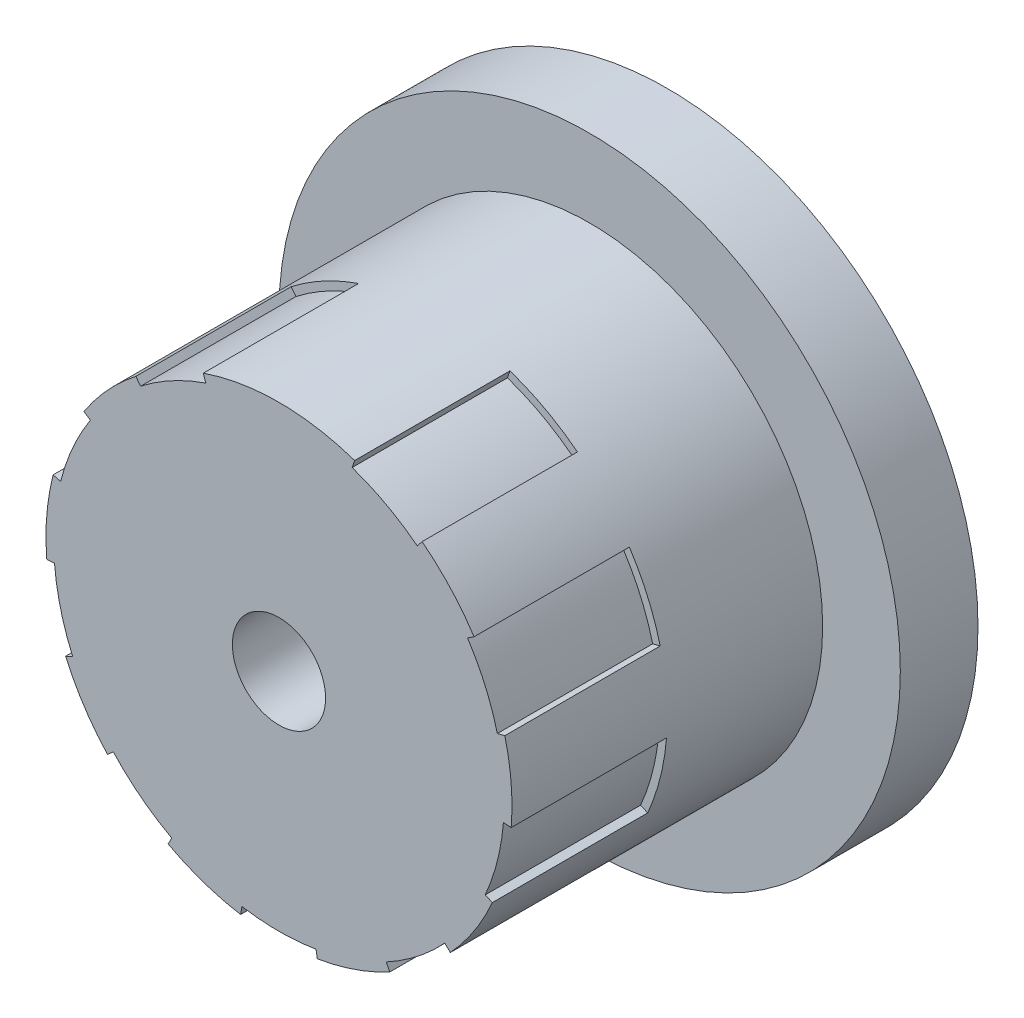
from build123d import *

# Parameters (mm, degrees)
BOSS_EXTRUDE1_DEPTH = 20
SKETCH1_7_R         = 20
BOSS_EXTRUDE5_DEPTH = 5
SKETCH4_R           = 15
SKETCH4_R_2         = 14.5
BOSS_EXTRUDE6_DEPTH = 10
SKETCH5_R           = 3
CUT_EXTRUDE1_DEPTH  = 20


with BuildPart() as part:
    # Sketch1 → Boss-Extrude1 (new body)
    with BuildSketch(Plane.XY):
        with BuildLine():
            ThreePointArc((-4.708142303, 13.714350005), (-6.901237199, 12.752369392), (-8.906084334, 11.442537386))
            Line((-8.906084334, 11.442537386), (-9.21319069, 11.837107641))
            ThreePointArc((-9.21319069, 11.837107641), (-11.03585866, 10.159223574), (-12.557497174, 8.204222372))
            Line((-12.557497174, 8.204222372), (-12.138913935, 7.930748293))
            ThreePointArc((-12.138913935, 7.930748293), (-13.278713236, 5.824583657), (-14.056303856, 3.559539564))
            Line((-14.056303856, 3.559539564), (-14.541003989, 3.682282307))
            ThreePointArc((-14.541003989, 3.682282307), (-14.948767395, 1.238690182), (-14.948767395, -1.238690182))
            Line((-14.948767395, -1.238690182), (-14.450475149, -1.197400509))
            ThreePointArc((-14.450475149, -1.197400509), (-14.056303856, -3.559539564), (-13.278713236, -5.824583657))
            Line((-13.278713236, -5.824583657), (-13.7365999, -6.02543137))
            ThreePointArc((-13.7365999, -6.02543137), (-12.557497174, -8.204222372), (-11.03585866, -10.159223574))
            Line((-11.03585866, -10.159223574), (-10.667996705, -9.820582789))
            ThreePointArc((-10.667996705, -9.820582789), (-8.906084334, -11.442537386), (-6.901237199, -12.752369392))
            Line((-6.901237199, -12.752369392), (-7.139210896, -13.192106268))
            ThreePointArc((-7.139210896, -13.192106268), (-4.870492038, -14.187258626), (-2.468918854, -14.795419551))
            Line((-2.468918854, -14.795419551), (-2.386621559, -14.302238899))
            ThreePointArc((-2.386621559, -14.302238899), (0, -14.5), (2.386621559, -14.302238899))
            Line((2.386621559, -14.302238899), (2.468918854, -14.795419551))
            ThreePointArc((2.468918854, -14.795419551), (4.870492038, -14.187258626), (7.139210896, -13.192106268))
            Line((7.139210896, -13.192106268), (6.901237199, -12.752369392))
            ThreePointArc((6.901237199, -12.752369392), (8.906084334, -11.442537386), (10.667996705, -9.820582789))
            Line((10.667996705, -9.820582789), (11.03585866, -10.159223574))
            ThreePointArc((11.03585866, -10.159223574), (12.557497174, -8.204222372), (13.7365999, -6.02543137))
            Line((13.7365999, -6.02543137), (13.278713236, -5.824583657))
            ThreePointArc((13.278713236, -5.824583657), (14.056303856, -3.559539564), (14.450475149, -1.197400509))
            Line((14.450475149, -1.197400509), (14.948767395, -1.238690182))
            ThreePointArc((14.948767395, -1.238690182), (14.948767395, 1.238690182), (14.541003989, 3.682282307))
            Line((14.541003989, 3.682282307), (14.056303856, 3.559539564))
            ThreePointArc((14.056303856, 3.559539564), (13.278713236, 5.824583657), (12.138913935, 7.930748293))
            Line((12.138913935, 7.930748293), (12.557497174, 8.204222372))
            ThreePointArc((12.557497174, 8.204222372), (11.03585866, 10.159223574), (9.21319069, 11.837107641))
            Line((9.21319069, 11.837107641), (8.906084334, 11.442537386))
            ThreePointArc((8.906084334, 11.442537386), (6.901237199, 12.752369392), (4.708142303, 13.714350005))
            Line((4.708142303, 13.714350005), (4.870492038, 14.187258626))
            ThreePointArc((4.870492038, 14.187258626), (0, 15), (-4.870492038, 14.187258626))
            Line((-4.870492038, 14.187258626), (-4.708142303, 13.714350005))
        make_face()
    extrude(amount=BOSS_EXTRUDE1_DEPTH)

    # Sketch1<7> → Boss-Extrude5 (add)
    with BuildSketch(Plane.XY):
        Circle(SKETCH1_7_R)
    extrude(amount=-BOSS_EXTRUDE5_DEPTH)

    # Sketch4 → Boss-Extrude6 (add)
    with BuildSketch(Plane.XY):
        Circle(SKETCH4_R)
        Circle(SKETCH4_R_2, mode=Mode.SUBTRACT)
    extrude(amount=BOSS_EXTRUDE6_DEPTH)

    # Sketch5 → Cut-Extrude1 (cut)
    with BuildSketch(Plane.XY.offset(20)):
        Circle(SKETCH5_R)
    extrude(amount=-CUT_EXTRUDE1_DEPTH, mode=Mode.SUBTRACT)


solid = part.part
